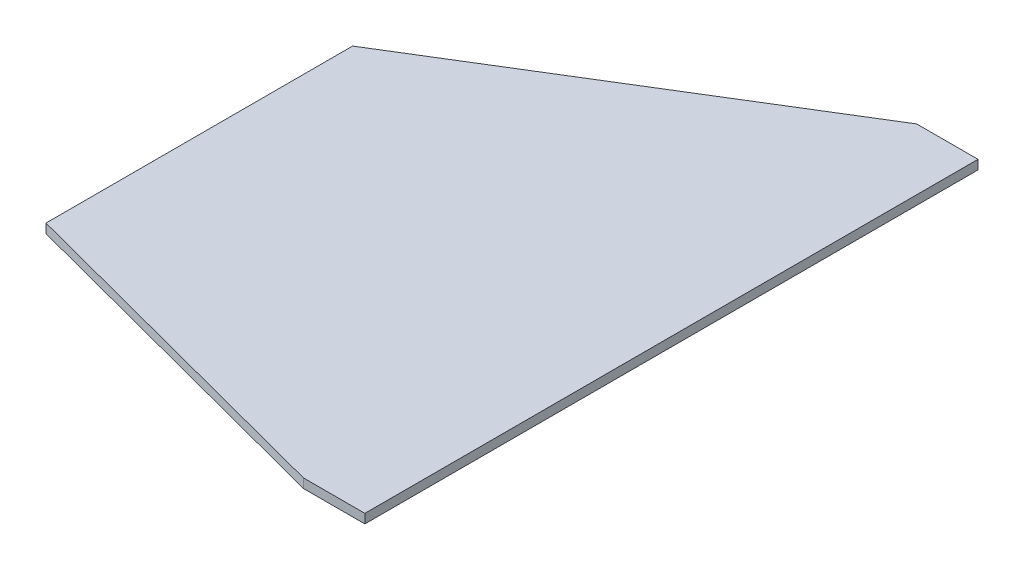
from build123d import *

# Parameters (mm, degrees)
SKETCH1_W           = 10
SKETCH1_H           = 100
BOSS_EXTRUDE1_DEPTH = 1.5


with BuildPart() as part:
    # Sketch1 → Boss-Extrude1 (new body)
    with BuildSketch(Plane(origin=(0, 0, 0), x_dir=(1, 0, 0), z_dir=(0, 1, 0))):
        Polygon((-57, 65), (-57, 15), (0, 0), (0, 100), align=None)
        with Locations((5, 50)):
            Rectangle(SKETCH1_W, SKETCH1_H)
    extrude(amount=BOSS_EXTRUDE1_DEPTH)


solid = part.part
